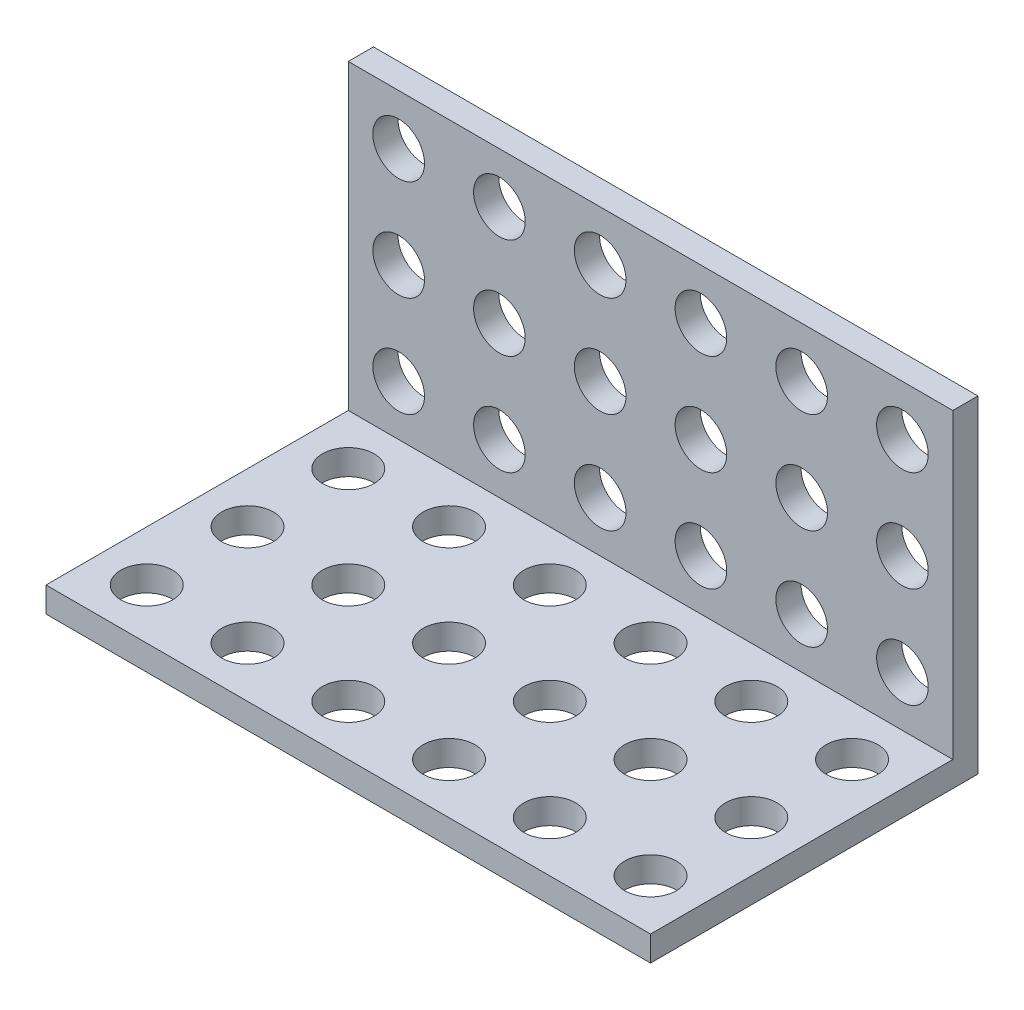
from build123d import *

# Parameters (mm, degrees)
BOSS_EXTRUDE1_DEPTH        = 48
F_4_1_4_1_DIAMETER_HOLE1_D = 4.1
LPATTERN1_COUNT            = 6
LPATTERN1_PITCH            = 8
LPATTERN1_COUNT_DIR2       = 3
LPATTERN1_PITCH_DIR2       = 8
MIRROR1_COPY_1_D           = 4.1
MIRROR1_COPY_2_D           = 4.1
MIRROR1_COPY_3_D           = 4.1
MIRROR1_COPY_4_D           = 4.1
MIRROR1_COPY_5_D           = 4.1
MIRROR1_COPY_6_D           = 4.1
MIRROR1_COPY_7_D           = 4.1
MIRROR1_COPY_8_D           = 4.1
MIRROR1_COPY_9_D           = 4.1
MIRROR1_COPY_10_D          = 4.1
MIRROR1_COPY_11_D          = 4.1
MIRROR1_COPY_12_D          = 4.1
MIRROR1_COPY_13_D          = 4.1
MIRROR1_COPY_14_D          = 4.1
MIRROR1_COPY_15_D          = 4.1
MIRROR1_COPY_16_D          = 4.1
MIRROR1_COPY_17_D          = 4.1


with BuildPart() as part:
    # Sketch3 → Boss-Extrude1 (new body)
    with BuildSketch(Plane(origin=(0, 0, 0), x_dir=(0, 0, -1), z_dir=(1, 0, 0))):
        Polygon((0, 0), (0, 26), (-2, 26), (-2, 2), (-26, 2), (-26, 0), align=None)
    extrude(amount=BOSS_EXTRUDE1_DEPTH)

    # Ø4.1 (4.1) Diameter Hole1 (through all)
    with Locations(Plane.XY.offset(2)):
        with Locations((4, 22)):
            f_4_1_4_1_diameter_hole1 = Hole(F_4_1_4_1_DIAMETER_HOLE1_D / 2)

    # LPattern1: 4.1 _4.1_ Diameter Hole1 6 × 3
    with Locations(*[(i * LPATTERN1_PITCH, -j * LPATTERN1_PITCH_DIR2, 0) for i in range(LPATTERN1_COUNT) for j in range(LPATTERN1_COUNT_DIR2) if (i, j) != (0, 0)]):
        add(f_4_1_4_1_diameter_hole1, mode=Mode.SUBTRACT)

    # Mirror1: Ø4.1 (4.1) Diameter Hole1 across plane
    add(f_4_1_4_1_diameter_hole1.mirror(Plane(origin=(0, 0, 0), x_dir=(0, 0.7071067811865471, 0.7071067811865479), z_dir=(0, -0.7071067811865479, 0.7071067811865471))), mode=Mode.SUBTRACT)

    # Mirror1 copy 1 (through all)
    with Locations(Plane(origin=(0, 2, -8), x_dir=(1, 0, 0), z_dir=(0, 1, 0))):
        with Locations((4, -22)):
            Hole(MIRROR1_COPY_1_D / 2)

    # Mirror1 copy 2 (through all)
    with Locations(Plane(origin=(0, 2, -16), x_dir=(1, 0, 0), z_dir=(0, 1, 0))):
        with Locations((4, -22)):
            Hole(MIRROR1_COPY_2_D / 2)

    # Mirror1 copy 3 (through all)
    with Locations(Plane(origin=(8, 2, 0), x_dir=(1, 0, 0), z_dir=(0, 1, 0))):
        with Locations((4, -22)):
            Hole(MIRROR1_COPY_3_D / 2)

    # Mirror1 copy 4 (through all)
    with Locations(Plane(origin=(8, 2, -8), x_dir=(1, 0, 0), z_dir=(0, 1, 0))):
        with Locations((4, -22)):
            Hole(MIRROR1_COPY_4_D / 2)

    # Mirror1 copy 5 (through all)
    with Locations(Plane(origin=(8, 2, -16), x_dir=(1, 0, 0), z_dir=(0, 1, 0))):
        with Locations((4, -22)):
            Hole(MIRROR1_COPY_5_D / 2)

    # Mirror1 copy 6 (through all)
    with Locations(Plane(origin=(16, 2, 0), x_dir=(1, 0, 0), z_dir=(0, 1, 0))):
        with Locations((4, -22)):
            Hole(MIRROR1_COPY_6_D / 2)

    # Mirror1 copy 7 (through all)
    with Locations(Plane(origin=(16, 2, -8), x_dir=(1, 0, 0), z_dir=(0, 1, 0))):
        with Locations((4, -22)):
            Hole(MIRROR1_COPY_7_D / 2)

    # Mirror1 copy 8 (through all)
    with Locations(Plane(origin=(16, 2, -16), x_dir=(1, 0, 0), z_dir=(0, 1, 0))):
        with Locations((4, -22)):
            Hole(MIRROR1_COPY_8_D / 2)

    # Mirror1 copy 9 (through all)
    with Locations(Plane(origin=(24, 2, 0), x_dir=(1, 0, 0), z_dir=(0, 1, 0))):
        with Locations((4, -22)):
            Hole(MIRROR1_COPY_9_D / 2)

    # Mirror1 copy 10 (through all)
    with Locations(Plane(origin=(24, 2, -8), x_dir=(1, 0, 0), z_dir=(0, 1, 0))):
        with Locations((4, -22)):
            Hole(MIRROR1_COPY_10_D / 2)

    # Mirror1 copy 11 (through all)
    with Locations(Plane(origin=(24, 2, -16), x_dir=(1, 0, 0), z_dir=(0, 1, 0))):
        with Locations((4, -22)):
            Hole(MIRROR1_COPY_11_D / 2)

    # Mirror1 copy 12 (through all)
    with Locations(Plane(origin=(32, 2, 0), x_dir=(1, 0, 0), z_dir=(0, 1, 0))):
        with Locations((4, -22)):
            Hole(MIRROR1_COPY_12_D / 2)

    # Mirror1 copy 13 (through all)
    with Locations(Plane(origin=(32, 2, -8), x_dir=(1, 0, 0), z_dir=(0, 1, 0))):
        with Locations((4, -22)):
            Hole(MIRROR1_COPY_13_D / 2)

    # Mirror1 copy 14 (through all)
    with Locations(Plane(origin=(32, 2, -16), x_dir=(1, 0, 0), z_dir=(0, 1, 0))):
        with Locations((4, -22)):
            Hole(MIRROR1_COPY_14_D / 2)

    # Mirror1 copy 15 (through all)
    with Locations(Plane(origin=(40, 2, 0), x_dir=(1, 0, 0), z_dir=(0, 1, 0))):
        with Locations((4, -22)):
            Hole(MIRROR1_COPY_15_D / 2)

    # Mirror1 copy 16 (through all)
    with Locations(Plane(origin=(40, 2, -8), x_dir=(1, 0, 0), z_dir=(0, 1, 0))):
        with Locations((4, -22)):
            Hole(MIRROR1_COPY_16_D / 2)

    # Mirror1 copy 17 (through all)
    with Locations(Plane(origin=(40, 2, -16), x_dir=(1, 0, 0), z_dir=(0, 1, 0))):
        with Locations((4, -22)):
            Hole(MIRROR1_COPY_17_D / 2)


solid = part.part
